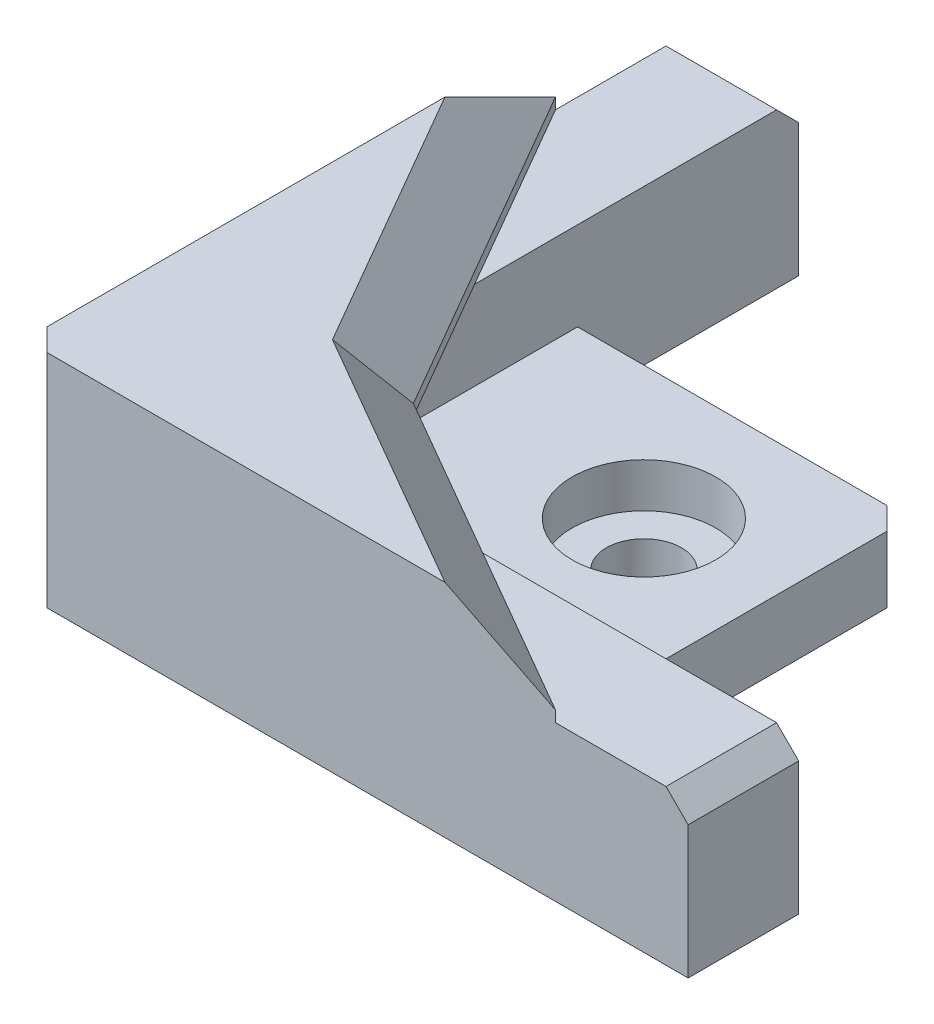
from build123d import *

# Parameters (mm, degrees)
BOSS_EXTRUDE1_DEPTH                                  = 3
BOSS_EXTRUDE2_DEPTH                                  = 4
REFRENTADO_PARA_TORNILLO_CON_CABEZA_PLAN_D           = 3.4
REFRENTADO_PARA_TORNILLO_CON_CABEZA_PLAN_DEPTH       = 40
REFRENTADO_PARA_TORNILLO_CON_CABEZA_PLAN_CBORE_D     = 6.5
REFRENTADO_PARA_TORNILLO_CON_CABEZA_PLAN_CBORE_DEPTH = 2
REFRENTADO_PARA_TORNILLO_CON_CABEZA_PLAN_TIP         = 1.021463052
BOSS_EXTRUDE3_START                                  = 2.5
SKETCH5_R                                            = 3
SKETCH5_R_2                                          = 1.7
BOSS_EXTRUDE3_DEPTH                                  = 2.5
BOSS_EXTRUDE4_DEPTH                                  = 3
CHAMFER1_SIZE                                        = 2.5
CHAMFER2_SIZE                                        = 1
FILLET2_R                                            = 1


with BuildPart() as part:
    # Sketch1 → Boss-Extrude1 (new body)
    with BuildSketch(Plane(origin=(0, 0, 0), x_dir=(1, 0, 0), z_dir=(0, 1, 0))):
        Polygon((0, 15), (0, 25), (-5, 25), (-5, -5), (25, -5), (25, 0), (15, 0), (15, 15), align=None)
    extrude(amount=BOSS_EXTRUDE1_DEPTH)

    # Sketch2 → Boss-Extrude2 (add)
    with BuildSketch(Plane(origin=(0, 3, 0), x_dir=(1, 0, 0), z_dir=(0, 1, 0))):
        Polygon((-5, 25), (0, 25), (0, 0), (25, 0), (25, -5), (-5, -5), align=None)
    extrude(amount=BOSS_EXTRUDE2_DEPTH)

    # Refrentado para tornillo con cabeza plana de M31
    with Locations(Plane(origin=(0, 3, 0), x_dir=(1, 0, 0), z_dir=(0, 1, 0))):
        with Locations((9, 9)):
            CounterBoreHole(REFRENTADO_PARA_TORNILLO_CON_CABEZA_PLAN_D / 2, REFRENTADO_PARA_TORNILLO_CON_CABEZA_PLAN_CBORE_D / 2, REFRENTADO_PARA_TORNILLO_CON_CABEZA_PLAN_CBORE_DEPTH, depth=REFRENTADO_PARA_TORNILLO_CON_CABEZA_PLAN_DEPTH)
            with Locations((0, 0, -(REFRENTADO_PARA_TORNILLO_CON_CABEZA_PLAN_DEPTH + REFRENTADO_PARA_TORNILLO_CON_CABEZA_PLAN_TIP / 2))):  # 118° drill point
                Cone(0, REFRENTADO_PARA_TORNILLO_CON_CABEZA_PLAN_D / 2, REFRENTADO_PARA_TORNILLO_CON_CABEZA_PLAN_TIP, mode=Mode.SUBTRACT)

    # Sketch5 → Boss-Extrude3 (add)
    with BuildSketch(Plane.XZ.offset(BOSS_EXTRUDE3_START)):
        with Locations(Location((9, -9, 0), (0, 0, 90))):
            Circle(SKETCH5_R)
        with Locations(Location((9, -9, 0), (0, 0, 90))):
            Circle(SKETCH5_R_2, mode=Mode.SUBTRACT)
    extrude(amount=-BOSS_EXTRUDE3_DEPTH)

    # Sketch6 → Boss-Extrude4 (add)
    with BuildSketch(Plane(origin=(0, 7, 0), x_dir=(1, 0, 0), z_dir=(0, 1, 0))):
        Polygon((-5, -5), (-5, 19), (3.788160363, 3.788160363), (19, -5), align=None)
    extrude(amount=BOSS_EXTRUDE4_DEPTH)

    # Chamfer1
    chamfer1_edges = [part.edges().sort_by_distance(p)[0] for p in [
        (11.394080181, 10, 0.605919819),
        (-0.605919819, 10, -11.394080181),
    ]]
    chamfer(chamfer1_edges, length=CHAMFER1_SIZE)

    # Chamfer2
    chamfer2_edges = [part.edges().sort_by_distance(p)[0] for p in [
        (15, 1.5, -15),
        (-5, 5, 5),
        (25, 7, 2.5),
        (-2.5, 7, -25),
    ]]
    chamfer(chamfer2_edges, length=CHAMFER2_SIZE)

    # Fillet2
    fillet2_edges = [part.edges().sort_by_distance(p)[0] for p in [
        (9, 0, -12),
    ]]
    fillet(fillet2_edges, radius=FILLET2_R)


solid = part.part
